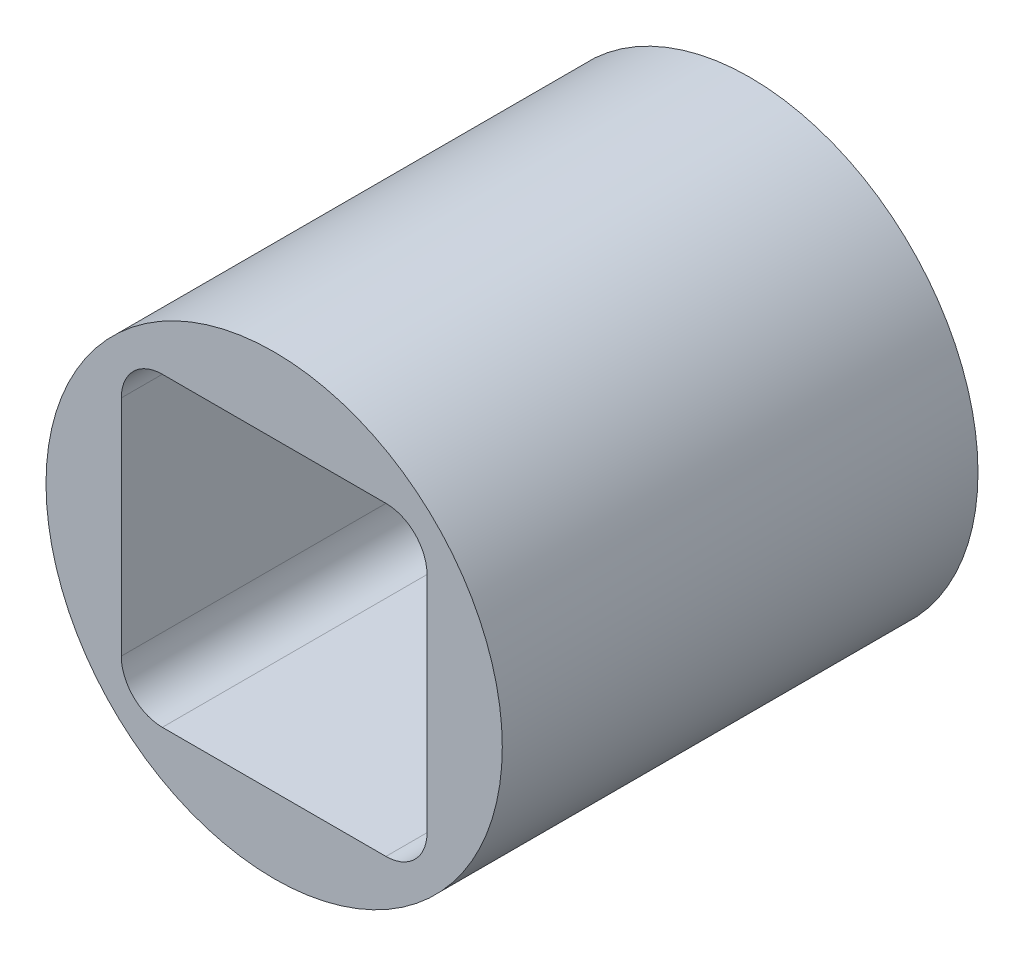
from build123d import *

# Parameters (mm, degrees)
SKETCH1_R           = 2.3876
SKETCH1_W           = 3.2
SKETCH1_H           = 3.2
BOSS_EXTRUDE1_DEPTH = 4.9784
FILLET1_R           = 0.43


with BuildPart() as part:
    # Sketch1 → Boss-Extrude1 (new body)
    with BuildSketch(Plane.XY):
        Circle(SKETCH1_R)
        Rectangle(SKETCH1_W, SKETCH1_H, mode=Mode.SUBTRACT)
    extrude(amount=BOSS_EXTRUDE1_DEPTH)

    # Fillet1
    fillet1_edges = [part.edges().sort_by_distance(p)[0] for p in [
        (-1.6, 1.6, 2.4892),
        (-1.6, -1.6, 2.4892),
        (1.6, -1.6, 2.4892),
        (1.6, 1.6, 2.4892),
    ]]
    fillet(fillet1_edges, radius=FILLET1_R)


solid = part.part
